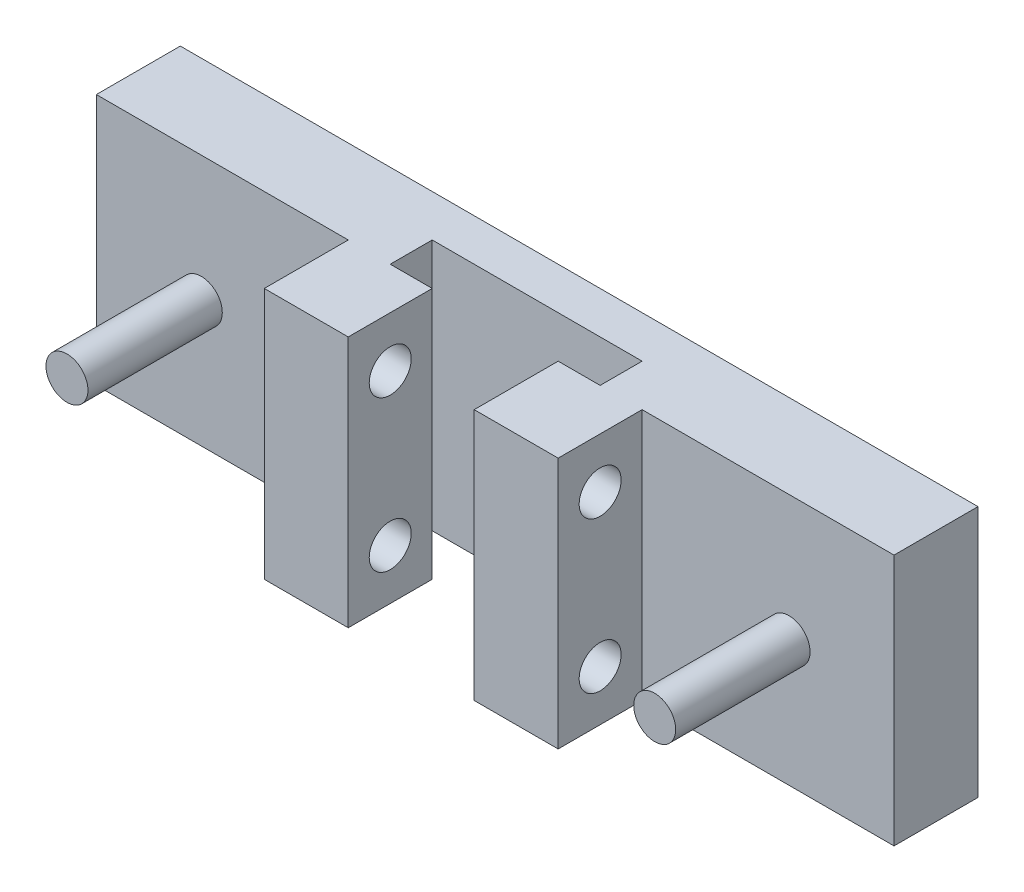
from build123d import *

# Parameters (mm, degrees)
SKETCH1_W               = 30
SKETCH1_H               = 10
BOSS_EXTRUDE1_DEPTH     = 30
CUT_EXTRUDE1_DEPTH      = 55
CUT_EXTRUDE1_DEPTH_BACK = 22
SKETCH2_R               = 2.5
SKETCH3_R               = 2.5
BOSS_EXTRUDE2_DEPTH     = 16


with BuildPart() as part:
    # Sketch1 → Boss-Extrude1 (new body)
    with BuildSketch(Plane(origin=(0, 0, 0), x_dir=(1, 0, 0), z_dir=(0, 1, 0))):
        with Locations((-15, 15)):
            Rectangle(SKETCH1_W, SKETCH1_H)
        Polygon((30, 15), (30, 10), (25, 10), (25, 0), (35, 0), (35, 20), (0, 20), (0, 0), (10, 0), (10, 10), (5, 10), (5, 15), align=None)
        with Locations((50, 15)):
            Rectangle(SKETCH1_W, SKETCH1_H)
    extrude(amount=BOSS_EXTRUDE1_DEPTH)

    # Sketch2 → Cut-Extrude1 (cut, two sides: drawn at the far end of the back side and taken through both)
    with BuildSketch(Plane(origin=(10, 0, 0), x_dir=(0, 0, -1), z_dir=(1, 0, 0)).offset(-CUT_EXTRUDE1_DEPTH_BACK)):
        with Locations(Location((5, 24, 0), (0, 0, 180))):
            Circle(SKETCH2_R)
        with Locations(Location((5, 6, 0), (0, 0, 180))):
            Circle(SKETCH2_R)
    extrude(amount=CUT_EXTRUDE1_DEPTH + CUT_EXTRUDE1_DEPTH_BACK, mode=Mode.SUBTRACT)

    # Sketch3 → Boss-Extrude2 (add)
    with BuildSketch(Plane.XY.offset(-10)):
        with Locations((-17.5, 15)):
            Circle(SKETCH3_R)
        with Locations(Location((52.5, 15, 0), (0, 0, 180))):
            Circle(SKETCH3_R)
    extrude(amount=BOSS_EXTRUDE2_DEPTH)


solid = part.part
